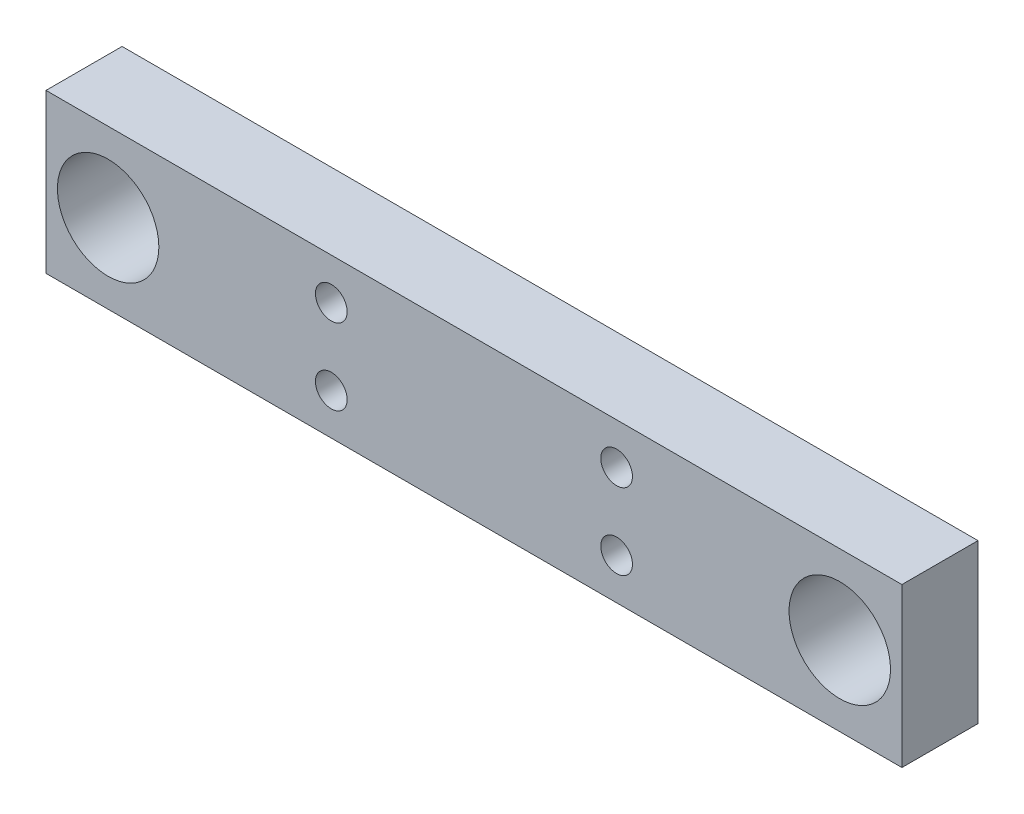
from build123d import *

# Parameters (mm, degrees)
SKETCH1_W                   = 135
SKETCH1_H                   = 25
BOSS_EXTRUDE1_DEPTH         = 6
TAP_DRILL_FOR_M6X1_0_TAP1_D = 5
SKETCH2_R                   = 8
CUT_EXTRUDE1_DEPTH          = 70.688593041


with BuildPart() as part:
    # Sketch1 → Boss-Extrude1 (new, symmetric)
    with BuildSketch(Plane.XY):
        Rectangle(SKETCH1_W, SKETCH1_H)
    extrude(amount=BOSS_EXTRUDE1_DEPTH, both=True)

    # Tap Drill for M6x1.0 Tap1 (through all)
    with Locations(Plane.XY.offset(6)):
        with Locations((-22.5, 6), (-22.5, -6), (22.5, 6), (22.5, -6)):
            Hole(TAP_DRILL_FOR_M6X1_0_TAP1_D / 2)

    # Sketch2 → Cut-Extrude1 (cut, through all)
    with BuildSketch(Plane.XY.offset(6)):
        with Locations((-57.7, 0)):
            Circle(SKETCH2_R)
        with Locations((57.7, 0)):
            Circle(SKETCH2_R)
    extrude(amount=-CUT_EXTRUDE1_DEPTH, mode=Mode.SUBTRACT)


solid = part.part
